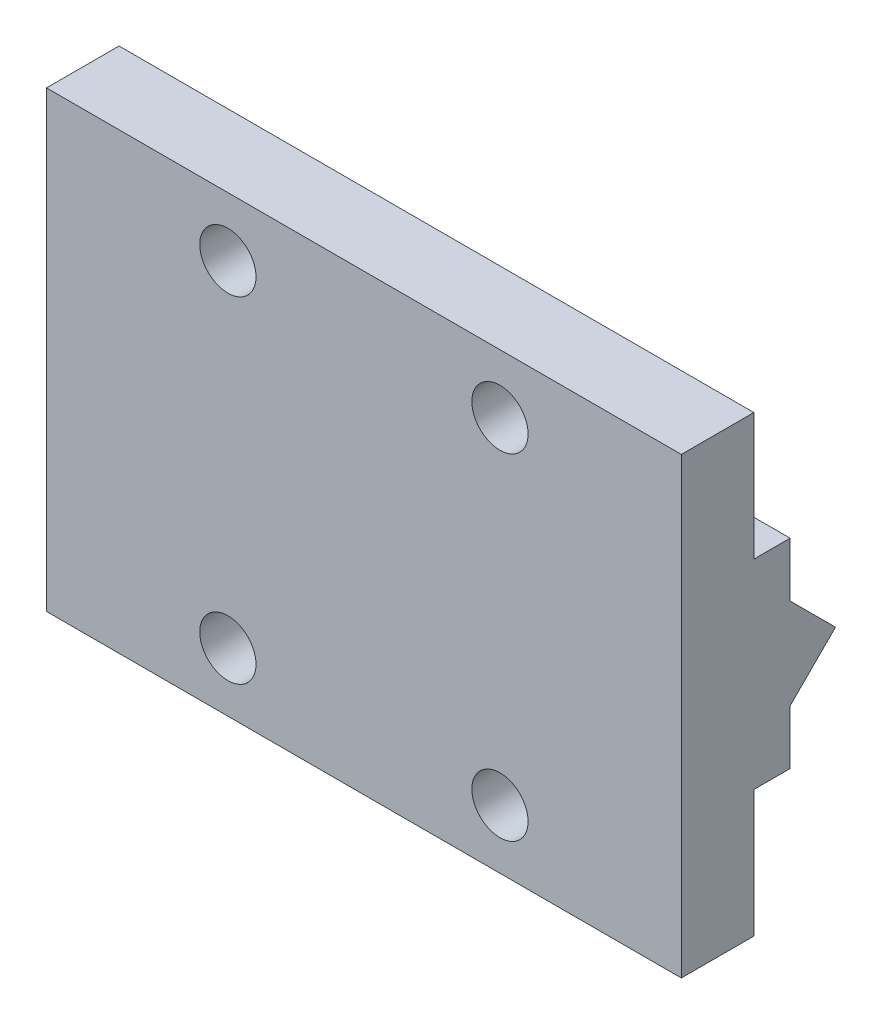
from build123d import *

# Parameters (mm, degrees)
SKETCH1_W           = 70
SKETCH1_H           = 50
SKETCH1_R           = 3.1
BOSS_EXTRUDE1_DEPTH = 8
SKETCH3_W           = 70
SKETCH3_H           = 22
BOSS_EXTRUDE2_DEPTH = 4
BOSS_EXTRUDE3_DEPTH = 70


with BuildPart() as part:
    # Sketch1 → Boss-Extrude1 (new body)
    with BuildSketch(Plane.XY):
        with Locations((-11.480938416, -0.439882698)):
            Rectangle(SKETCH1_W, SKETCH1_H)
        with Locations((-26.480938416, 18.060117302)):
            Circle(SKETCH1_R, mode=Mode.SUBTRACT)
        with Locations((3.519061584, 18.060117302)):
            Circle(SKETCH1_R, mode=Mode.SUBTRACT)
        with Locations((-26.480938416, -18.939882698)):
            Circle(SKETCH1_R, mode=Mode.SUBTRACT)
        with Locations((3.519061584, -18.939882698)):
            Circle(SKETCH1_R, mode=Mode.SUBTRACT)
    extrude(amount=BOSS_EXTRUDE1_DEPTH)

    # Sketch3 → Boss-Extrude2 (add)
    with BuildSketch(Plane(origin=(0, 0, 0), x_dir=(-1, 0, 0), z_dir=(0, 0, -1))):
        with Locations((11.480938416, -0.439882698)):
            Rectangle(SKETCH3_W, SKETCH3_H)
    extrude(amount=BOSS_EXTRUDE2_DEPTH)

    # Sketch4 → Boss-Extrude3 (add)
    with BuildSketch(Plane.ZY.offset(46.480938416)):
        Polygon((-9, -0.439882698), (-4, -5.439882698), (-4, -0.439882698), (-4, 4.560117302), align=None)
    extrude(amount=-BOSS_EXTRUDE3_DEPTH)


solid = part.part
